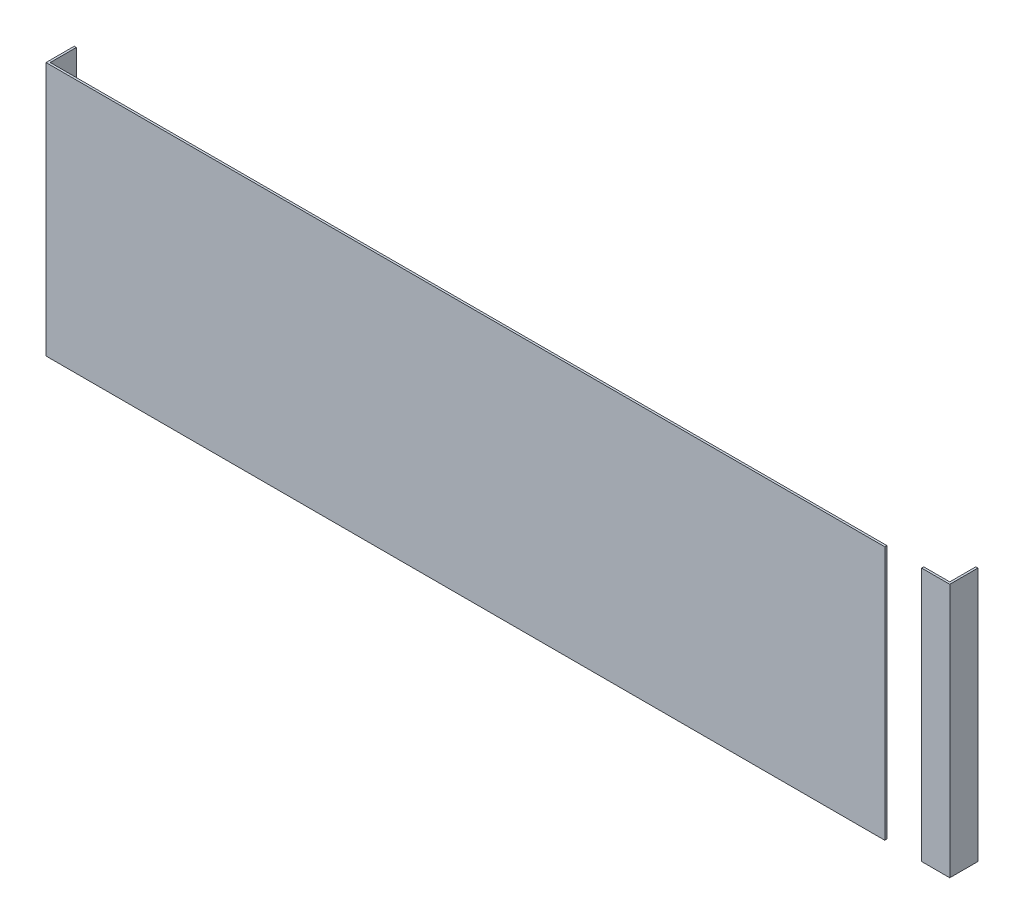
from build123d import *

# Parameters (mm, degrees)
PACK_PANO_KAPAGI_KAPAK_1_START = 120
PACK_PANO_KAPAGI_KAPAK_1_DEPTH = 180
PACK_PANO_KAPAGI_KAPAK_2_START = 27
SKETCH2_W                      = 26
SKETCH2_H                      = 180
PACK_PANO_KAPAGI_KAPAK_2_DEPTH = 14


with BuildPart() as part:
    # Sketch1 → PACK_pano_kapagi_kapak_1 (new body)
    with BuildSketch(Plane(origin=(0, 0, 0), x_dir=(1, 0, 0), z_dir=(0, 1, 0)).offset(PACK_PANO_KAPAGI_KAPAK_1_START)):
        Polygon((30, -40), (30, -20), (31.5, -20), (31.5, -38.5), (668.5, -38.5), (668.5, -20), (670, -20), (670, -40), align=None)
    extrude(amount=PACK_PANO_KAPAGI_KAPAK_1_DEPTH)

    # Sketch2 → PACK_pano_kapagi_kapak_2 (cut)
    with BuildSketch(Plane.XY.offset(PACK_PANO_KAPAGI_KAPAK_2_START)):
        with Locations((637, 210)):
            Rectangle(SKETCH2_W, SKETCH2_H)
    extrude(amount=PACK_PANO_KAPAGI_KAPAK_2_DEPTH, mode=Mode.SUBTRACT)


with BuildPart() as pack_pano_kapagi_kapak_2_piece_1:
    # of the separate pieces the step leaves, piece 1, a body of its own (pack_pano_kapagi_kapak_2_pieces)
    add(part.part.solids().sort_by_distance((30, 120, 40))[0])


with BuildPart() as pack_pano_kapagi_kapak_2_piece_2:
    # of the separate pieces the step leaves, piece 2, a body of its own (pack_pano_kapagi_kapak_2_pieces)
    add(part.part.solids().sort_by_distance((670, 120, 40))[0])


solid = Compound([pack_pano_kapagi_kapak_2_piece_1.part, pack_pano_kapagi_kapak_2_piece_2.part])
